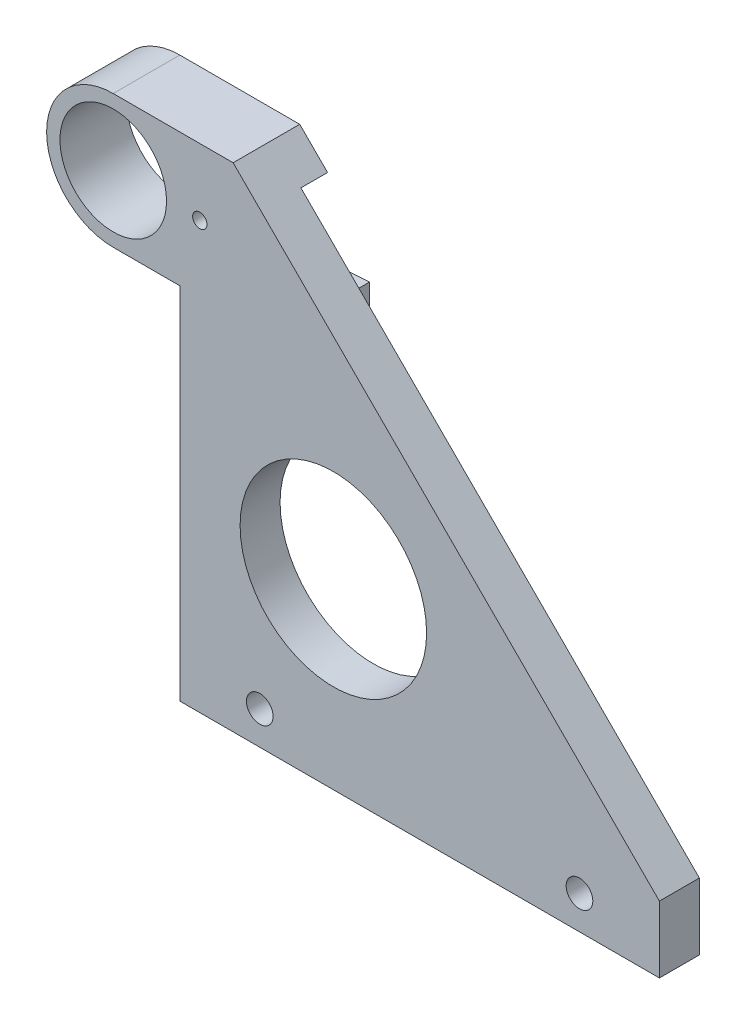
from build123d import *

# Parameters (mm, degrees)
EXTRUDE_1_DEPTH     = 3
SKETCH_3_R          = 7
CUT_EXTRUDE_1_DEPTH = 47.49731175
SKETCH_4_R          = 1
CUT_EXTRUDE_2_DEPTH = 47.49731175
FILLET_1_RADIUS     = 5
FILLET_1_LENGTH     = 3
EXTRUDE_2_DEPTH     = 2
SKETCH_7_R          = 4
CUT_EXTRUDE_3_DEPTH = 47.669047558
CUT_EXTRUDE_4_DEPTH = 2
SKETCH_9_R          = 0.537141257
CUT_EXTRUDE_5_DEPTH = 47.49731175
SKETCH_10_R         = 1.85
CUT_EXTRUDE_6_DEPTH = 1.5


with BuildPart() as part:
    # 草图1 → 凸台-拉伸1 (new body)
    with BuildSketch(Plane.XY):
        Polygon((-18, 0), (18, 0), (18, 5), (-14, 37), (-28, 37), (-28, 27), (-18, 27), align=None)
    extrude(amount=EXTRUDE_1_DEPTH)

    # 草图3 → 切除-拉伸1 (cut, through all)
    with BuildSketch(Plane.XY.offset(3)):
        with Locations((-6.476357534, 13.687539211)):
            Circle(SKETCH_3_R)
    extrude(amount=-CUT_EXTRUDE_1_DEPTH, mode=Mode.SUBTRACT)

    # 草图4 → 切除-拉伸2 (cut, through all)
    with BuildSketch(Plane.XY.offset(3)):
        with Locations((12, 2.5)):
            Circle(SKETCH_4_R)
        with Locations(Location((-12, 2.5, 0), (0, 0, 180))):
            Circle(SKETCH_4_R)
    extrude(amount=-CUT_EXTRUDE_2_DEPTH, mode=Mode.SUBTRACT)

    # 圆角1: full round fillet: the end face becomes a half cylinder, R = half its width
    fillet_1_face = Plane((-28, 32, 1.5), x_dir=(0, 0, 1), z_dir=(-1, 0, 0))  # on the end face: x along it, z out of the body
    fillet_1_slab = fillet_1_face.offset(-FILLET_1_RADIUS / 2) * Box(FILLET_1_LENGTH, 2 * FILLET_1_RADIUS, FILLET_1_RADIUS, mode=Mode.PRIVATE)  # the body's end, R deep
    fillet_1_round = Plane((-23, 32, 1.5), x_dir=(-1, 0, 0), z_dir=(0, 0, 1)) * Cylinder(FILLET_1_RADIUS, FILLET_1_LENGTH, mode=Mode.PRIVATE)  # its axis R under the face
    add(fillet_1_slab - fillet_1_round, mode=Mode.SUBTRACT)

    # 草图6 → 凸台-拉伸2 (add)
    with BuildSketch(Plane(origin=(0, 0, 0), x_dir=(-1, 0, 0), z_dir=(0, 0, -1))):
        with BuildLine():
            Line((23, 37), (14, 37))
            Line((14, 37), (8.769916503, 31.769916503))
            Line((8.769916503, 31.769916503), (8.769916503, 27))
            Line((8.769916503, 27), (23, 27))
            ThreePointArc((23, 27), (28, 32), (23, 37))
        make_face()
    extrude(amount=EXTRUDE_2_DEPTH)

    # 草图7 → 切除-拉伸3 (cut, through all)
    with BuildSketch(Plane.XY.offset(3)):
        with Locations((-23, 32)):
            Circle(SKETCH_7_R)
    extrude(amount=-CUT_EXTRUDE_3_DEPTH, mode=Mode.SUBTRACT)

    # 草图8 → 切除-拉伸4 (cut)
    with BuildSketch(Plane(origin=(0, 0, -2), x_dir=(-1, 0, 0), z_dir=(0, 0, -1))):
        Polygon((20.974712791, 35.449378454), (20.974712791, 28.550621546), (7.021339854, 29.472936706), (7.021339854, 34.618719507), align=None)
    extrude(amount=-CUT_EXTRUDE_4_DEPTH, mode=Mode.SUBTRACT)

    # 草图9 → 切除-拉伸5 (cut, through all)
    with BuildSketch(Plane(origin=(0, 0, 0), x_dir=(-1, 0, 0), z_dir=(0, 0, -1))):
        with Locations((16.5, 32)):
            Circle(SKETCH_9_R)
    extrude(amount=-CUT_EXTRUDE_5_DEPTH, mode=Mode.SUBTRACT)

    # 草图10 → 切除-拉伸6 (cut)
    with BuildSketch(Plane(origin=(0, 0, 0), x_dir=(-1, 0, 0), z_dir=(0, 0, -1))):
        with Locations((12, 2.5)):
            Circle(SKETCH_10_R)
        with Locations((-12, 2.5)):
            Circle(SKETCH_10_R)
    extrude(amount=-CUT_EXTRUDE_6_DEPTH, mode=Mode.SUBTRACT)


solid = part.part
